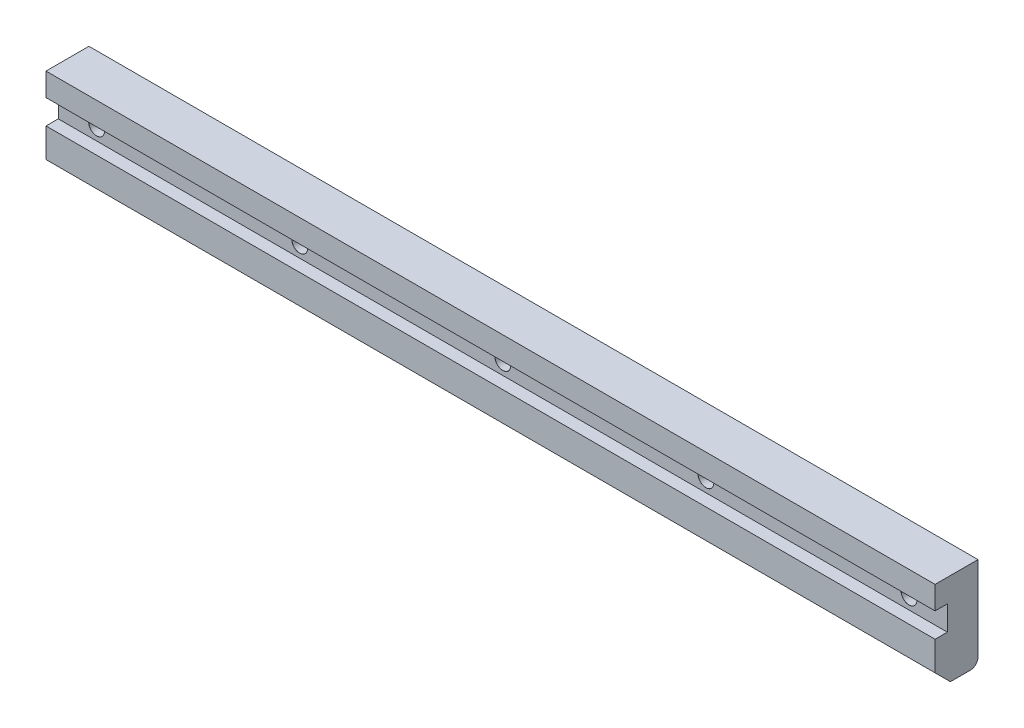
from build123d import *

# Parameters (mm, degrees)
BOSS_EXTRUDE1_DEPTH                     = 290
TAP_DRILL_FOR_M10_HELICOIL1_D           = 10.25
TAP_DRILL_FOR_M10_HELICOIL1_CSINK_D     = 10.3
TAP_DRILL_FOR_M10_HELICOIL1_CSINK_ANGLE = 90


with BuildPart() as part:
    # Sketch1 → Boss-Extrude1 (new, symmetric)
    with BuildSketch(Plane(origin=(0, 0, 0), x_dir=(0, 0, -1), z_dir=(1, 0, 0))):
        with BuildLine():
            Line((0, 0), (-28, 0))
            Line((-28, 0), (-28, -15))
            Line((-28, -15), (-20, -15))
            Line((-20, -15), (-20, -31))
            Line((-20, -31), (-28, -31))
            Line((-28, -31), (-28, -50))
            Line((-28, -50), (-18, -60))
            Line((-18, -60), (-5, -60))
            ThreePointArc((-5, -60), (-1.464466094, -58.535533906), (0, -55))
            Line((0, -55), (0, 0))
        make_face()
    extrude(amount=BOSS_EXTRUDE1_DEPTH, both=True)

    # Tap Drill for M10 Helicoil1 (through all)
    with Locations(Plane(origin=(-265, -23, 20), x_dir=(1, 0, 0), z_dir=(0, 0, 1))):
        with Locations((0, 0), (132.5, 0), (265, 0), (397.5, 0), (530, 0)):
            CounterSinkHole(TAP_DRILL_FOR_M10_HELICOIL1_D / 2, TAP_DRILL_FOR_M10_HELICOIL1_CSINK_D / 2, counter_sink_angle=TAP_DRILL_FOR_M10_HELICOIL1_CSINK_ANGLE)


solid = part.part
